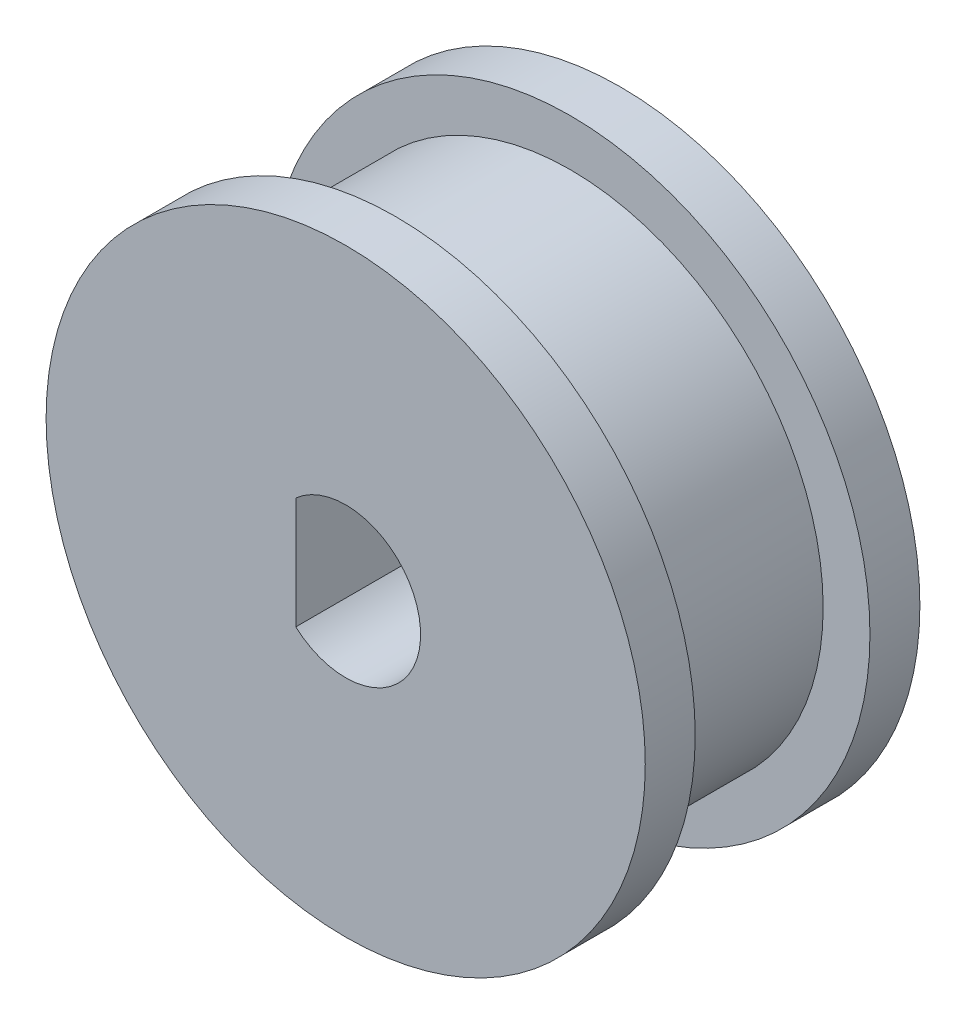
from build123d import *

# Parameters (mm, degrees)
SKETCH_1_R          = 10.125
EXTRUDE_1_DEPTH     = 3.5
SKETCH_2_R          = 12
EXTRUDE_2_DEPTH     = 2
CUT_EXTRUDE_1_DEPTH = 21.223748416
SKETCH_4_R          = 1.5
CUT_EXTRUDE_2_DEPTH = 18.839562775


with BuildPart() as part:
    # 草图1 → 凸台-拉伸1 (new, symmetric)
    with BuildSketch(Plane.XY):
        Circle(SKETCH_1_R)
    extrude(amount=EXTRUDE_1_DEPTH, both=True)

    # 草图2 → 凸台-拉伸2 (add)
    with BuildSketch(Plane.XY.offset(3.5)):
        Circle(SKETCH_2_R)
    extrude_2 = extrude(amount=EXTRUDE_2_DEPTH)

    # 镜向1: 凸台-拉伸2 across plane
    add(extrude_2.mirror(Plane.XY))

    # 草图3 → 切除-拉伸1 (cut, through all)
    with BuildSketch(Plane.XY.offset(5.5)):
        with BuildLine():
            Line((-2, 2.236067977), (-2, -2.236067977))
            ThreePointArc((-2, -2.236067977), (3, 0), (-2, 2.236067977))
        make_face()
    extrude(amount=-CUT_EXTRUDE_1_DEPTH, mode=Mode.SUBTRACT)

    # 草图4 → 切除-拉伸2 (cut, through all)
    with BuildSketch(Plane(origin=(0, 0, 0), x_dir=(1, 0, 0), z_dir=(0, 1, 0))):
        with Locations(Location((0, 0, 0), (0, 0, 270))):
            Circle(SKETCH_4_R)
    extrude(amount=-CUT_EXTRUDE_2_DEPTH, mode=Mode.SUBTRACT)


solid = part.part
